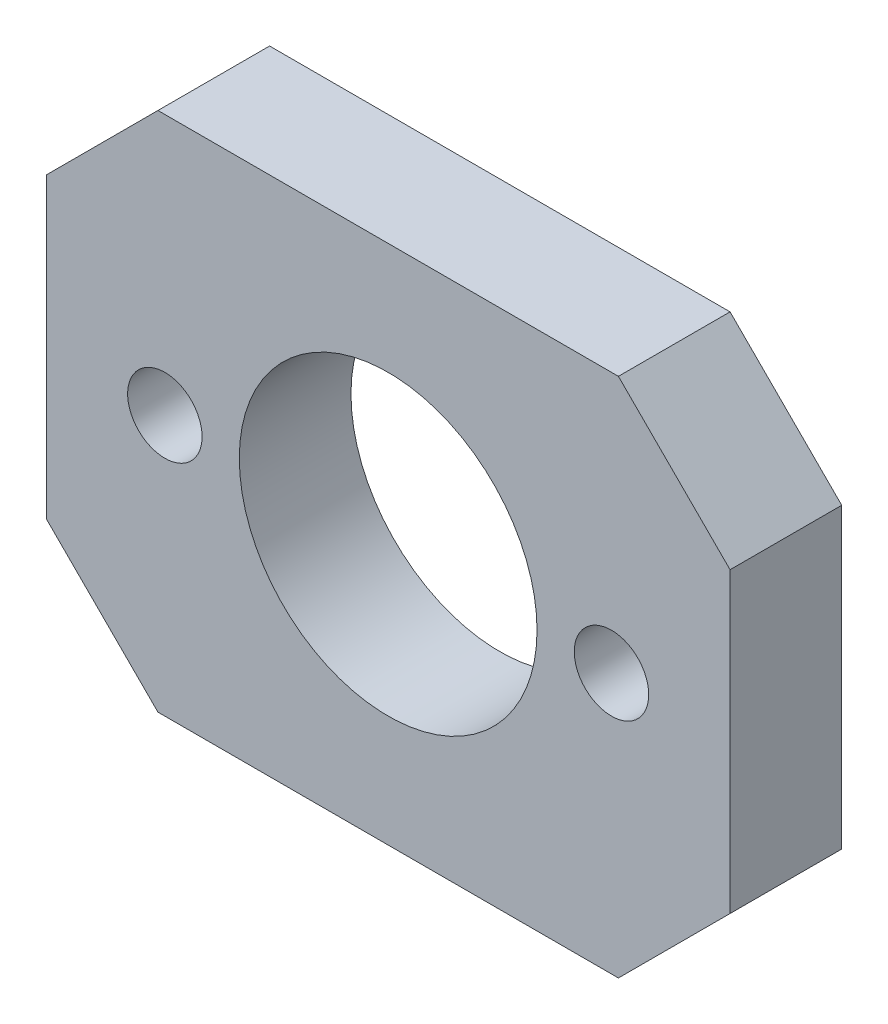
from build123d import *

# Parameters (mm, degrees)
SKETCH1_W           = 18.372011154
SKETCH1_H           = 14
SKETCH1_R           = 1
SKETCH1_R_2         = 4
BOSS_EXTRUDE1_DEPTH = 3
CHAMFER1_SIZE       = 3


with BuildPart() as part:
    # Sketch1 → Boss-Extrude1 (new body)
    with BuildSketch(Plane.XY):
        Rectangle(SKETCH1_W, SKETCH1_H)
        with Locations((-6, 0)):
            Circle(SKETCH1_R, mode=Mode.SUBTRACT)
        with Locations((6, 0)):
            Circle(SKETCH1_R, mode=Mode.SUBTRACT)
        Circle(SKETCH1_R_2, mode=Mode.SUBTRACT)
    extrude(amount=BOSS_EXTRUDE1_DEPTH)

    # Chamfer1
    chamfer1_edges = [part.edges().sort_by_distance(p)[0] for p in [
        (9.186005577, -7, 1.5),
        (-9.186005577, -7, 1.5),
        (-9.186005577, 7, 1.5),
        (9.186005577, 7, 1.5),
    ]]
    chamfer(chamfer1_edges, length=CHAMFER1_SIZE)


solid = part.part
